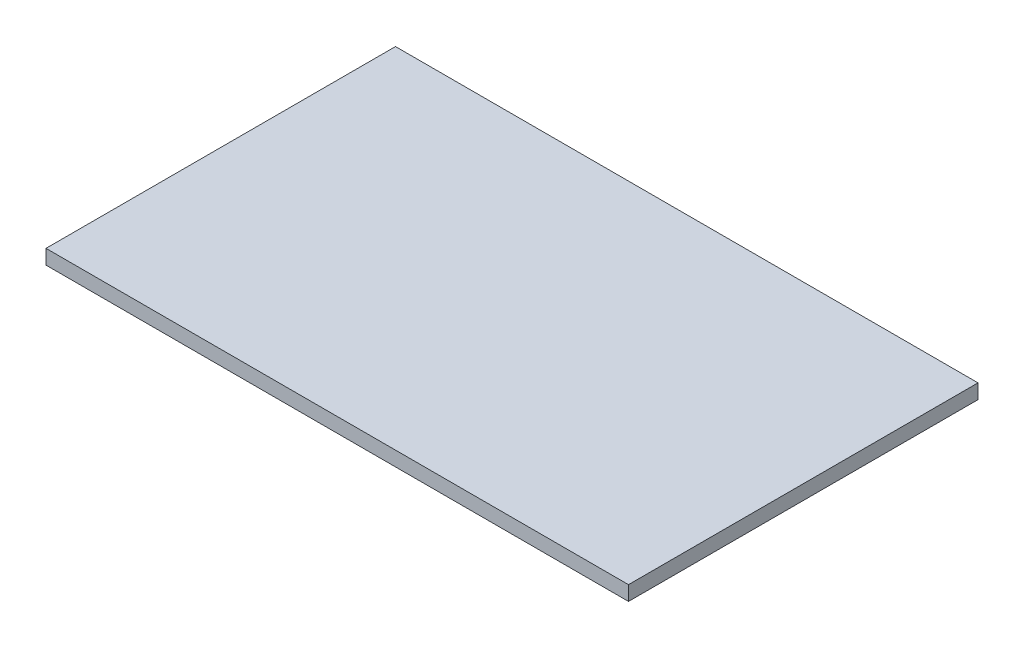
from build123d import *

# Parameters (mm, degrees)
IZIM1_W                     = 200
IZIM1_H                     = 120
Y_KSEKLIK_EKSTR_ZYON1_DEPTH = 5
SCALE3_SCALE                = 0.6


with BuildPart() as part:
    # Çizim1 → Yükseklik-Ekstrüzyon1 (new body)
    with BuildSketch(Plane(origin=(0, 0, 0), x_dir=(1, 0, 0), z_dir=(0, 1, 0))):
        with Locations((100, 60)):
            Rectangle(IZIM1_W, IZIM1_H)
    extrude(amount=Y_KSEKLIK_EKSTR_ZYON1_DEPTH)


with BuildPart() as part_1:
    # Scale3: scaled about (100, 2.5, -60)
    add(part.part.scale(SCALE3_SCALE).moved(Location((40, 1, -24))))


solid = part_1.part
